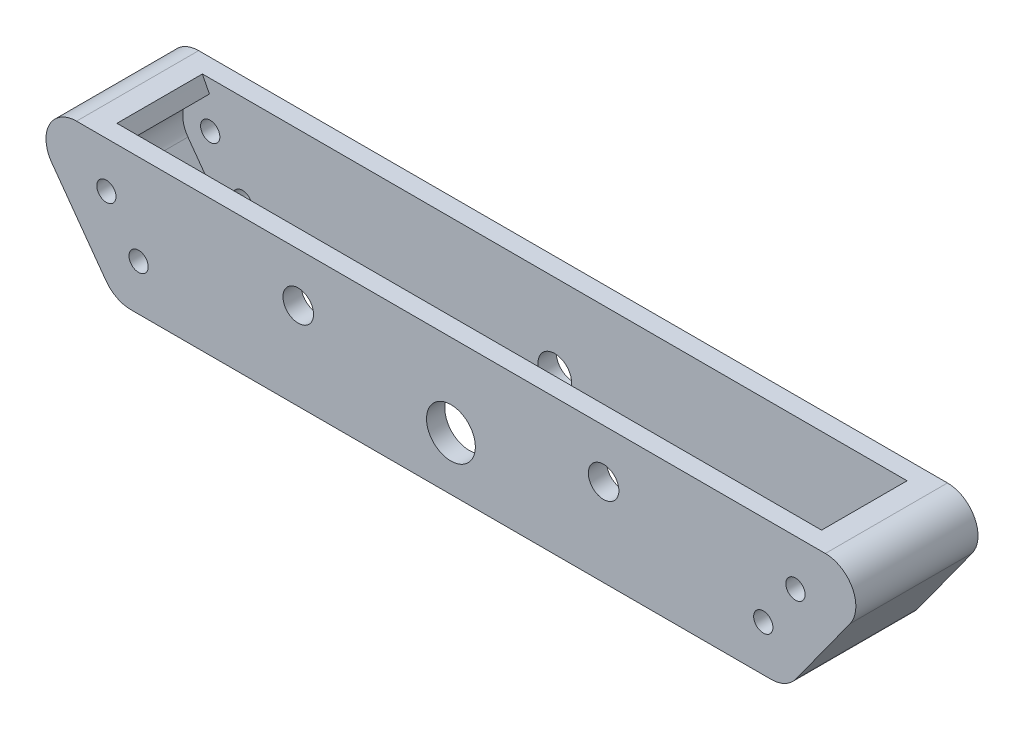
from build123d import *

# Parameters (mm, degrees)
BOSS_EXTRUDE1_DEPTH   = 7
BOSS_EXTRUDE1_2_DEPTH = 7
SKETCH2_R             = 4
SKETCH2_R_2           = 1.575
BOSS_EXTRUDE2_DEPTH   = 3
FILLET1_R             = 5
FILLET2_R             = 1
SKETCH3_R             = 6.014810067
SKETCH3_R_2           = 2.75
BOSS_EXTRUDE3_DEPTH   = 3
SKETCH4_R             = 2.5
CUT_EXTRUDE1_DEPTH    = 10


with BuildPart() as part:
    # Sketch1 → Boss-Extrude1 (new, symmetric)
    with BuildSketch(Plane.XY):
        with BuildLine():
            Line((-57.692807239, -27.704512139), (-71.0874428, -27.704512139))
            Line((-71.0874428, -27.704512139), (-54.981120944, -50))
            Line((-54.981120944, -50), (-39.949968711, -50))
            ThreePointArc((-39.949968711, -50), (-43.032344249, -47.373171188), (-45.942408988, -44.556649968))
            Line((-45.942408988, -44.556649968), (-48.76458719, -46.317700387))
            ThreePointArc((-48.76458719, -46.317700387), (-52.012858014, -46.915883336), (-54.794591341, -45.135140265))
            Line((-54.794591341, -45.135140265), (-60.064871871, -37.839652404))
            ThreePointArc((-60.064871871, -37.839652404), (-60.833011276, -34.338501535), (-58.79938816, -31.386811752))
            Line((-58.79938816, -31.386811752), (-56.544061175, -29.979478746))
            ThreePointArc((-56.544061175, -29.979478746), (-57.129759272, -28.847714043), (-57.692807239, -27.704512139))
        make_face()
    extrude(amount=BOSS_EXTRUDE1_DEPTH, both=True)



with BuildPart() as body_2:
    # Sketch1 → Boss-Extrude1 2 (new, symmetric)
    with BuildSketch(Plane.XY):
        with BuildLine():
            Line((39.949968711, -50), (54.981120944, -50))
            Line((54.981120944, -50), (71.0874428, -27.704512139))
            Line((71.0874428, -27.704512139), (57.692807239, -27.704512139))
            ThreePointArc((57.692807239, -27.704512139), (57.129759272, -28.847714043), (56.544061175, -29.979478746))
            Line((56.544061175, -29.979478746), (58.79938816, -31.386811752))
            ThreePointArc((58.79938816, -31.386811752), (60.833011276, -34.338501535), (60.064871871, -37.839652404))
            Line((60.064871871, -37.839652404), (54.794591341, -45.135140265))
            ThreePointArc((54.794591341, -45.135140265), (52.012858014, -46.915883336), (48.76458719, -46.317700387))
            Line((48.76458719, -46.317700387), (45.942408988, -44.556649968))
            ThreePointArc((45.942408988, -44.556649968), (43.032344249, -47.373171188), (39.949968711, -50))
        make_face()
    extrude(amount=BOSS_EXTRUDE1_2_DEPTH, both=True)


with BuildPart() as part_1:
    add(part.part)

    add(body_2.part)  # Boss-Extrude2 merges body 2
    # Sketch2 → Boss-Extrude2 (add)
    with BuildSketch(Plane.XY.offset(7)):
        Polygon((-54.981120944, -50), (54.981120944, -50), (71.0874428, -27.704512139), (-71.0874428, -27.704512139), align=None)
        with Locations((0, -41.25)):
            Circle(SKETCH2_R, mode=Mode.SUBTRACT)
        with Locations((-51.14684741, -42.5)):
            Circle(SKETCH2_R_2, mode=Mode.SUBTRACT)
        with Locations((-56.417127941, -35.204512139)):
            Circle(SKETCH2_R_2, mode=Mode.SUBTRACT)
        with Locations((56.417127941, -35.204512139)):
            Circle(SKETCH2_R_2, mode=Mode.SUBTRACT)
        with Locations((51.14684741, -42.5)):
            Circle(SKETCH2_R_2, mode=Mode.SUBTRACT)
    boss_extrude2 = extrude(amount=BOSS_EXTRUDE2_DEPTH)

    # Mirror2: Boss-Extrude2 across plane
    add(boss_extrude2.mirror(Plane.XY))

    # Fillet1
    fillet1_edges = [part_1.edges().sort_by_distance(p)[0] for p in [
        (-54.981120944, -50, 0),
        (-71.0874428, -27.704512139, 0),
        (54.981120944, -50, 0),
        (71.0874428, -27.704512139, 0),
    ]]
    fillet(fillet1_edges, radius=FILLET1_R)

    # Fillet2
    fillet2_edges = [part_1.edges().sort_by_distance(p)[0] for p in [
        (-39.949968711, -50, 0),
        (39.949968711, -50, 0),
    ]]
    fillet(fillet2_edges, radius=FILLET2_R)

    # Sketch3 → Boss-Extrude3 (add)
    with BuildSketch(Plane(origin=(0, 0, -10), x_dir=(-1, 0, 0), z_dir=(0, 0, -1))):
        with Locations((0, -41.25)):
            Circle(SKETCH3_R)
        with Locations((0, -41.25)):
            Circle(SKETCH3_R_2, mode=Mode.SUBTRACT)
    extrude(amount=-BOSS_EXTRUDE3_DEPTH)

    # Sketch4 → Cut-Extrude1 (cut)
    with BuildSketch(Plane.XY.offset(10)):
        with Locations((-25, -35.704512139)):
            Circle(SKETCH4_R)
        with Locations((25, -35.704512139)):
            Circle(SKETCH4_R)
    extrude(amount=-CUT_EXTRUDE1_DEPTH, mode=Mode.SUBTRACT)


solid = part_1.part
